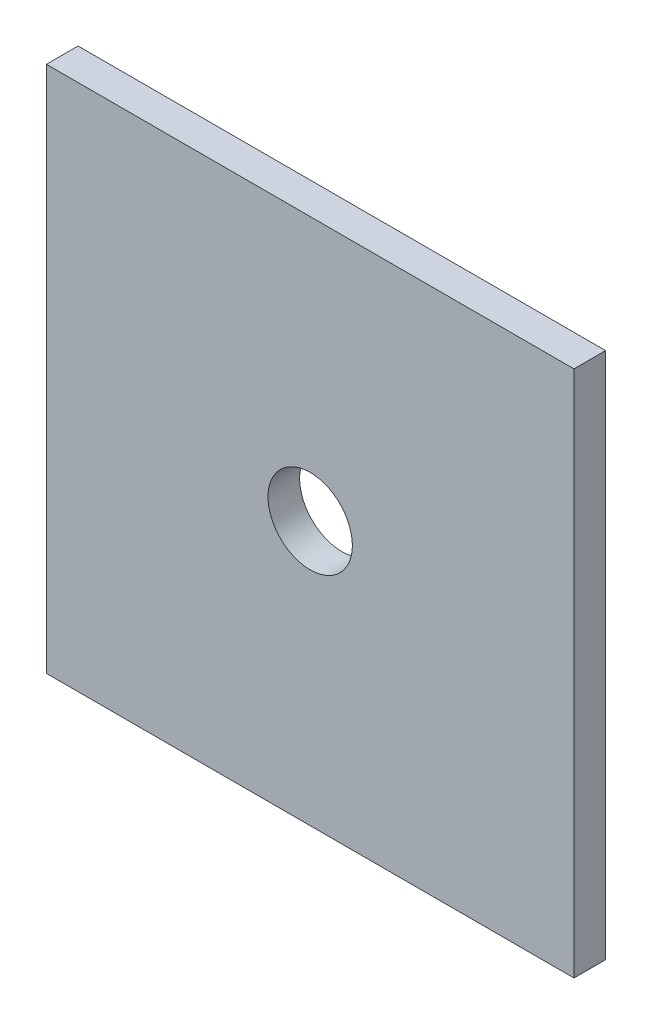
from build123d import *

# Parameters (mm, degrees)
CROQUIS1_W              = 50
CROQUIS1_H              = 50
CROQUIS1_R              = 4
SALIENTE_EXTRUIR1_DEPTH = 3


with BuildPart() as part:
    # Croquis1 → Saliente-Extruir1 (new body)
    with BuildSketch(Plane.XY):
        Rectangle(CROQUIS1_W, CROQUIS1_H)
        Circle(CROQUIS1_R, mode=Mode.SUBTRACT)
    extrude(amount=SALIENTE_EXTRUIR1_DEPTH)


solid = part.part
